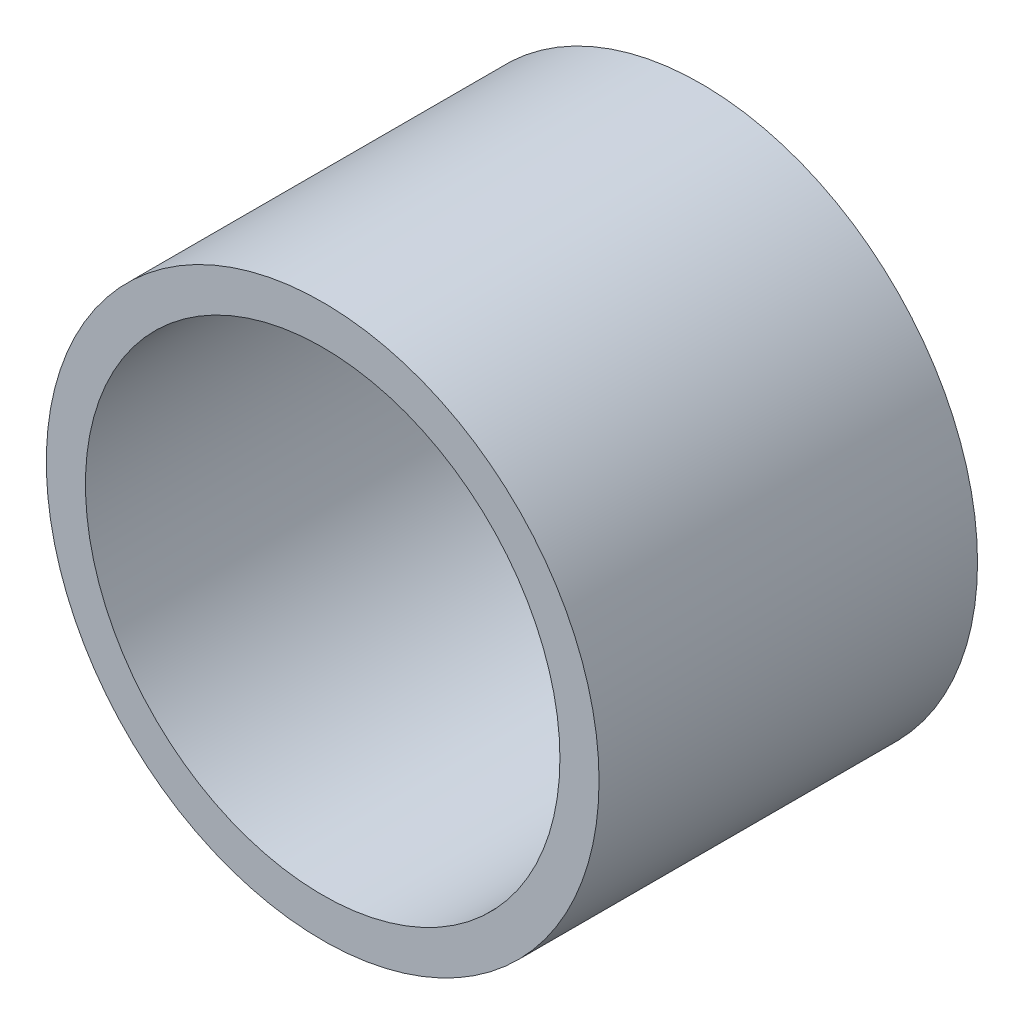
from build123d import *

# Parameters (mm, degrees)
SKETCH1_R           = 36.5125
SKETCH1_R_2         = 31.3436
BOSS_EXTRUDE1_DEPTH = 50


with BuildPart() as part:
    # Sketch1 → Boss-Extrude1 (new body)
    with BuildSketch(Plane.XY):
        Circle(SKETCH1_R)
        Circle(SKETCH1_R_2, mode=Mode.SUBTRACT)
    extrude(amount=BOSS_EXTRUDE1_DEPTH)


solid = part.part
